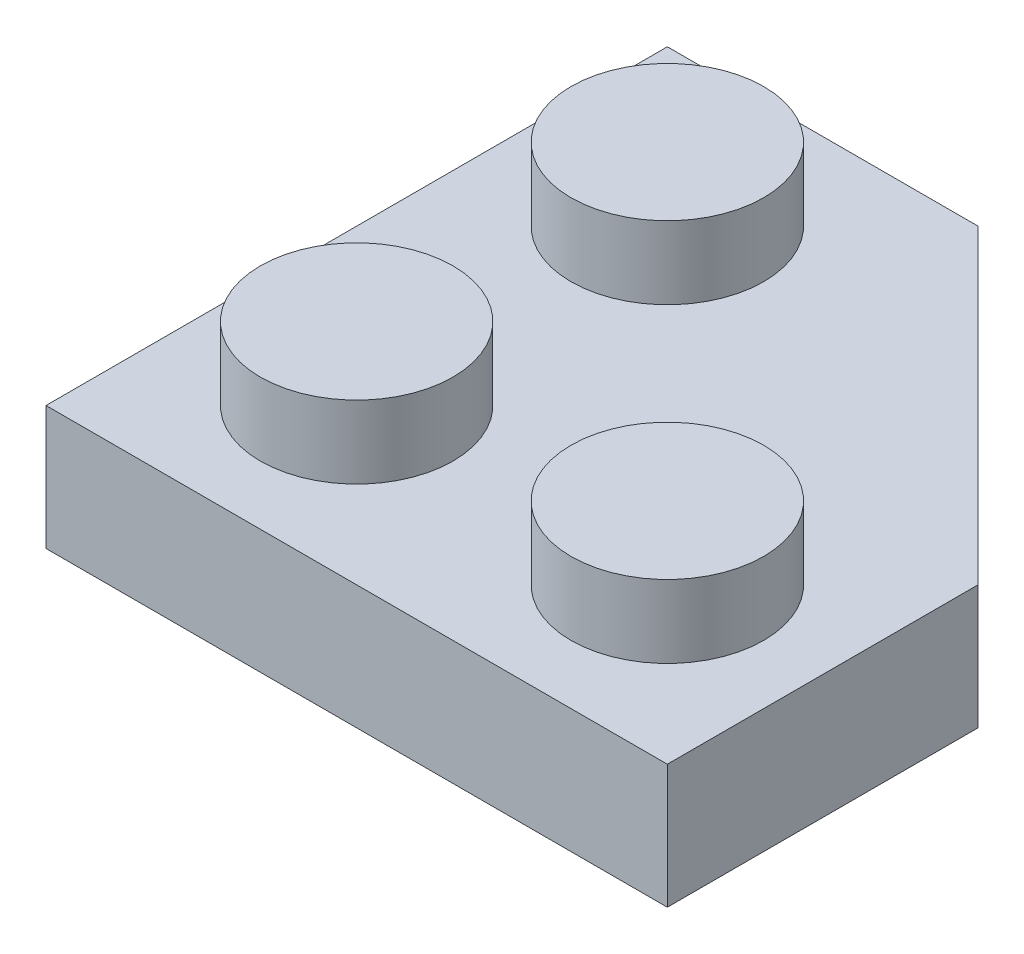
from build123d import *

# Parameters (mm, degrees)
SKETCH1_W               = 15.8
SKETCH1_H               = 15.8
BOSS_EXTRUDE1_DEPTH     = 3.15
SKETCH2_R               = 2.45
BOSS_EXTRUDE2_DEPTH     = 1.85
CUT_EXTRUDE1_DEPTH      = 12.607863714
CUT_EXTRUDE1_DEPTH_BACK = 12.607863714
SHELL1_T                = -1.5
SKETCH4_W               = 5
SKETCH4_H               = 1.65
CUT_EXTRUDE2_DEPTH      = 1.5
FILLET1_R               = 0.2
SKETCH5_R               = 3.25
SKETCH5_R_2             = 2.44
BOSS_EXTRUDE3_DEPTH     = 1.45


with BuildPart() as part:
    # Sketch1 → Boss-Extrude1 (new body)
    with BuildSketch(Plane(origin=(0, 0, 0), x_dir=(1, 0, 0), z_dir=(0, 1, 0))):
        Rectangle(SKETCH1_W, SKETCH1_H)
    extrude(amount=-BOSS_EXTRUDE1_DEPTH)

    # Sketch2 → Boss-Extrude2 (add)
    with BuildSketch(Plane(origin=(0, 0, 0), x_dir=(1, 0, 0), z_dir=(0, 1, 0))):
        with Locations(Location((-3.95, 3.95, 0), (0, 0, 270))):
            Circle(SKETCH2_R)
        with Locations(Location((-3.95, -3.95, 0), (0, 0, 270))):
            Circle(SKETCH2_R)
        with Locations(Location((3.95, -3.95, 0), (0, 0, 270))):
            Circle(SKETCH2_R)
    extrude(amount=BOSS_EXTRUDE2_DEPTH)

    # Sketch3 → Cut-Extrude1 (cut, two sides: drawn at the far end of the back side and taken through both)
    with BuildSketch(Plane(origin=(0, 0, 0), x_dir=(1, 0, 0), z_dir=(0, 1, 0)).offset(-CUT_EXTRUDE1_DEPTH_BACK)):
        Polygon((0, 7.9), (7.9, 0), (7.9, 7.9), align=None)
    extrude(amount=CUT_EXTRUDE1_DEPTH + CUT_EXTRUDE1_DEPTH_BACK, mode=Mode.SUBTRACT)

    # Shell1
    shell1_openings = [part.faces().sort_by_distance(p)[0] for p in [
        (-0.752380952, -3.15, 0.752380952),
    ]]
    offset(amount=SHELL1_T, openings=shell1_openings, kind=Kind.INTERSECTION)

    # Sketch4 → Cut-Extrude2 (cut)
    with BuildSketch(Plane(origin=(3.95, 0, -3.95), x_dir=(-0.7071067811865475, 0, -0.7071067811865477), z_dir=(0.7071067811865477, 0, -0.7071067811865475))):
        with Locations((0, -2.325)):
            Rectangle(SKETCH4_W, SKETCH4_H)
    extrude(amount=-CUT_EXTRUDE2_DEPTH, mode=Mode.SUBTRACT)

    # Fillet1
    fillet1_edges = [part.edges().sort_by_distance(p)[0] for p in [
        (5.187436867, -3.15, -1.651902961),
        (5.187436867, -1.5, -1.651902961),
        (1.651902961, -1.5, -5.187436867),
        (1.651902961, -3.15, -5.187436867),
    ]]
    fillet(fillet1_edges, radius=FILLET1_R)

    # Sketch5 → Boss-Extrude3 (add)
    with BuildSketch(Plane.XZ.offset(1.5)):
        with Locations(Location((0, 0, 0), (0, 0, 90))):
            Circle(SKETCH5_R)
        with Locations(Location((0, 0, 0), (0, 0, 90))):
            Circle(SKETCH5_R_2, mode=Mode.SUBTRACT)
    extrude(amount=BOSS_EXTRUDE3_DEPTH)


solid = part.part
